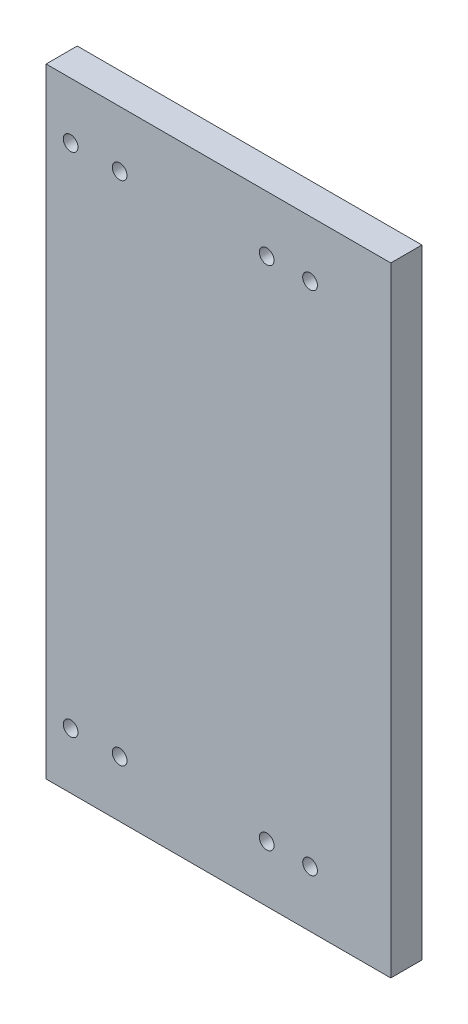
from build123d import *

# Parameters (mm, degrees)
SKETCH2_R           = 1.5
BOSS_EXTRUDE3_DEPTH = 6.35


with BuildPart() as part:
    # Sketch2 → Boss-Extrude3 (new body)
    with BuildSketch(Plane.XY):
        Polygon((-5.178463077, 27.016673705), (-5.178463077, 43.486673705), (-5.178463077, 136.886673705), (-5.178463077, 153.356673705), (65.137170919, 153.356673705), (65.137170919, 27.016673705), align=None)
        with Locations((39.821536923, 38.486673705)):
            Circle(SKETCH2_R, mode=Mode.SUBTRACT)
        with Locations((9.821536923, 38.486673705)):
            Circle(SKETCH2_R, mode=Mode.SUBTRACT)
        with Locations((-0.178463077, 38.486673705)):
            Circle(SKETCH2_R, mode=Mode.SUBTRACT)
        with Locations((48.671536923, 38.486673705)):
            Circle(SKETCH2_R, mode=Mode.SUBTRACT)
        with Locations(Location((48.671536923, 141.886673705, 0), (0, 0, 180))):
            Circle(SKETCH2_R, mode=Mode.SUBTRACT)
        with Locations(Location((-0.178463077, 141.886673705, 0), (0, 0, 180))):
            Circle(SKETCH2_R, mode=Mode.SUBTRACT)
        with Locations(Location((9.821536923, 141.886673705, 0), (0, 0, 180))):
            Circle(SKETCH2_R, mode=Mode.SUBTRACT)
        with Locations(Location((39.821536923, 141.886673705, 0), (0, 0, 180))):
            Circle(SKETCH2_R, mode=Mode.SUBTRACT)
    extrude(amount=BOSS_EXTRUDE3_DEPTH)


solid = part.part
